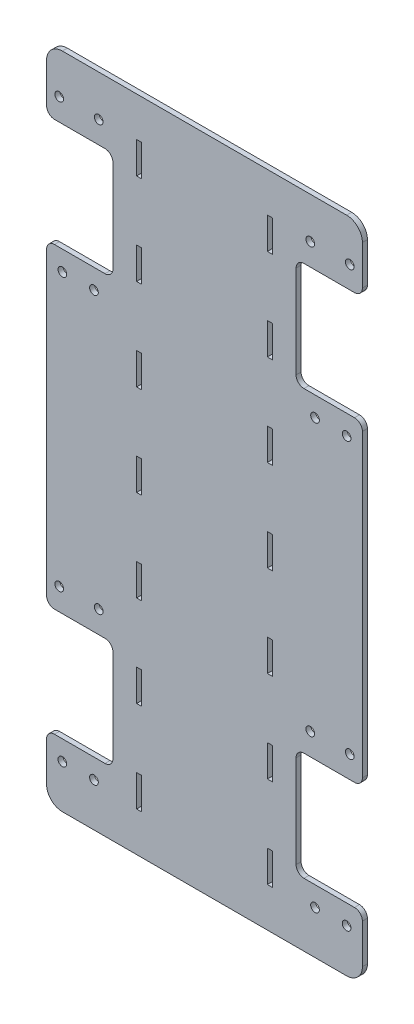
from build123d import *

# Parameters (mm, degrees)
BOSS_EXTRU_1_DEPTH      = 3.175
ESQUISSE2_W             = 3.175
ESQUISSE2_H             = 20
ENL_V_MAT_EXTRU_1_DEPTH = 232.35263263
D_GAGEMENT_M51_D        = 5.5
CONG_1_R                = 5
CONG_2_R                = 10


with BuildPart() as part:
    # Esquisse1 → Boss.-Extru.1 (new body)
    with BuildSketch(Plane.XY):
        Polygon((100, 208.6), (-100, 208.6), (-100, 168.6), (-58, 168.6), (-58, 100), (-100, 100), (-100, -100), (-58, -100), (-58, -168.6), (-100, -168.6), (-100, -208.6), (100, -208.6), (100, -168.6), (58, -168.6), (58, -100), (100, -100), (100, 100), (58, 100), (58, 168.6), (100, 168.6), align=None)
    extrude(amount=BOSS_EXTRU_1_DEPTH)

    # Esquisse2 → Enlèv. mat.-Extru.1 (cut, symmetric)
    with BuildSketch(Plane.XY.offset(3.175)):
        with Locations((-41.4125, 173.6)):
            Rectangle(ESQUISSE2_W, ESQUISSE2_H)
        with Locations((-41.4125, 115.733333333)):
            Rectangle(ESQUISSE2_W, ESQUISSE2_H)
        with Locations((-41.4125, 57.866666667)):
            Rectangle(ESQUISSE2_W, ESQUISSE2_H)
        with Locations((-41.4125, 0)):
            Rectangle(ESQUISSE2_W, ESQUISSE2_H)
        with Locations((-41.4125, -57.866666667)):
            Rectangle(ESQUISSE2_W, ESQUISSE2_H)
        with Locations((-41.4125, -115.733333333)):
            Rectangle(ESQUISSE2_W, ESQUISSE2_H)
        with Locations((-41.4125, -173.6)):
            Rectangle(ESQUISSE2_W, ESQUISSE2_H)
    enl_v_mat_extru_1 = extrude(amount=ENL_V_MAT_EXTRU_1_DEPTH, both=True, mode=Mode.SUBTRACT)

    # Symétrie1: Enlèv. mat.-Extru.1 across plane
    add(enl_v_mat_extru_1.mirror(Plane(origin=(0, 0, 0), x_dir=(0, 0, 1), z_dir=(1, 0, 0))), mode=Mode.SUBTRACT)

    # Dégagement M51 (through all)
    with Locations(Plane(origin=(90, -181.1, 3.175), x_dir=(1, 0, 0), z_dir=(0, 0, 1))):
        with Locations((0, 0), (-20, 0), (-180, 0), (-160, 0), (-182, 95.1), (-157, 95.1), (-23, 95.1), (2, 95.1), (-20, 268.6), (0, 268.6), (-23, 363.7), (2, 363.7), (-180, 268.6), (-160, 268.6), (-182, 363.7), (-157, 363.7)):
            Hole(D_GAGEMENT_M51_D / 2)

    # Congé1
    cong_1_edges = [part.edges().sort_by_distance(p)[0] for p in [
        (100, 168.6, 1.5875),
        (58, 168.6, 1.5875),
        (58, 100, 1.5875),
        (100, 100, 1.5875),
        (100, -100, 1.5875),
        (58, -100, 1.5875),
        (58, -168.6, 1.5875),
        (100, -168.6, 1.5875),
        (-100, -168.6, 1.5875),
        (-58, -168.6, 1.5875),
        (-58, -100, 1.5875),
        (-100, -100, 1.5875),
        (-100, 100, 1.5875),
        (-58, 100, 1.5875),
        (-58, 168.6, 1.5875),
        (-100, 168.6, 1.5875),
    ]]
    fillet(cong_1_edges, radius=CONG_1_R)

    # Congé2
    cong_2_edges = [part.edges().sort_by_distance(p)[0] for p in [
        (100, -208.6, 1.5875),
        (-100, -208.6, 1.5875),
        (-100, 208.6, 1.5875),
        (100, 208.6, 1.5875),
    ]]
    fillet(cong_2_edges, radius=CONG_2_R)


solid = part.part
